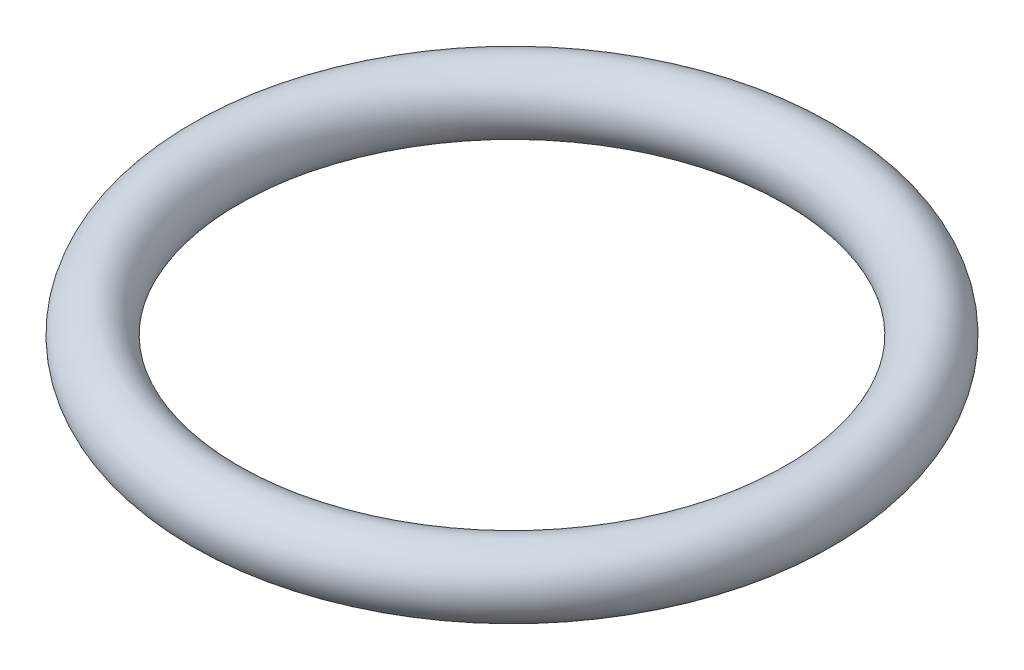
from build123d import *

# Parameters (mm, degrees)
SWEEP1_PROFILE_R = 2.5


with BuildPart() as part:
    # Sweep1: sweep along a path in Sketch3
    with BuildLine(Plane(origin=(0, 0, 0), x_dir=(1, 0, 0), z_dir=(0, 1, 0))) as sweep1_path:
        CenterArc((0, 0), 22.5, 0, 360)
    # Sweep1 profile (on start of the path) → Sweep1 (sweep)
    with BuildSketch(Plane(origin=(22.5, 0, 0), x_dir=(-1, 0, 0), z_dir=(0, 0, -1))):
        Circle(SWEEP1_PROFILE_R)
    sweep(path=sweep1_path.line)


solid = part.part
